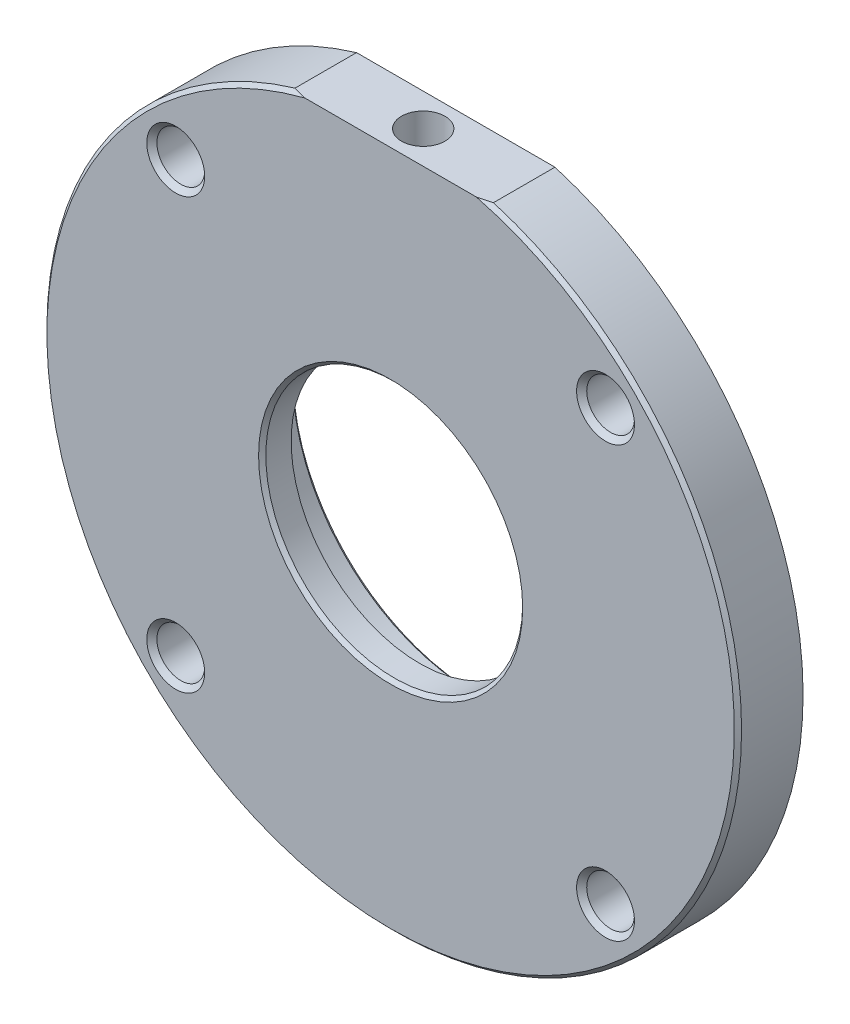
from build123d import *

# Parameters (mm, degrees)
CIRPATTERN1_COUNT               = 4
SKETCH4_W                       = 93.853238467
SKETCH4_H                       = 20.664933241
CUT_EXTRUDE1_DEPTH              = 69.476273263
F_3_0MM_DOWEL_HOLE1_D           = 3
F_3_0MM_DOWEL_HOLE1_DEPTH       = 9.098709071
F_3_0MM_DOWEL_HOLE1_CSINK_D     = 3.5
F_3_0MM_DOWEL_HOLE1_CSINK_ANGLE = 90
F_3_0MM_DOWEL_HOLE1_TIP         = 0.901290929


with BuildPart() as part:
    # Sketch1 → Revolve1 (revolve)
    with BuildSketch(Plane(origin=(0, 0, 0), x_dir=(0, 0, -1), z_dir=(1, 0, 0)), mode=Mode.PRIVATE) as revolve1_sk:
        Polygon((0, -18.25), (0, -47.5), (0.5, -48), (9, -48), (9, -36), (13.5, -36), (14, -35.5), (14, -30), (12, -30), (12, -25.5), (11.5, -25), (4, -25), (4, -17.75), (0.5, -17.75), align=None)
    revolve(revolve1_sk.sketch.rotate(Axis((0, 0, 0), (0, 0, -1)), 270), axis=Axis((0, 0, 0), (0, 0, -1)))

    # Sketch3 → Ø6.0mm Dowel Hole1 (revolve, cut)
    with BuildSketch(Plane(origin=(-29.69848481, 29.69848481, -9), x_dir=(0, 1, 0), z_dir=(1, 0, 0))):
        Polygon((0, 0), (0, 9), (4, 9), (3.3, 8.3), (3.3, 0.7), (4, 0), align=None)
    f_6_0mm_dowel_hole1 = revolve(axis=Axis((-29.69848481, 29.69848481, -15.35), (0, 0, 1)), mode=Mode.SUBTRACT)

    # CirPattern1: Ø6.0mm Dowel Hole1 ×4 about axis
    cirpattern1_axis = Axis((0, 0, 0), (0, 0, 1))
    for i in range(1, CIRPATTERN1_COUNT):
        add(f_6_0mm_dowel_hole1.rotate(cirpattern1_axis, i * 360 / CIRPATTERN1_COUNT), mode=Mode.SUBTRACT)

    # Sketch4 → Cut-Extrude1 (cut, through all)
    with BuildSketch(Plane(origin=(0, 0, -9), x_dir=(-1, 0, 0), z_dir=(0, 0, -1))):
        with Locations((-0.198842092, 56.33246662)):
            Rectangle(SKETCH4_W, SKETCH4_H)
    extrude(amount=-CUT_EXTRUDE1_DEPTH, mode=Mode.SUBTRACT)

    # Ø3.0mm Dowel Hole1
    with Locations(Plane(origin=(0, 0, -12), x_dir=(-1, 0, 0), z_dir=(0, 0, -1))):
        with Locations((0, 28)):
            CounterSinkHole(F_3_0MM_DOWEL_HOLE1_D / 2, F_3_0MM_DOWEL_HOLE1_CSINK_D / 2, depth=F_3_0MM_DOWEL_HOLE1_DEPTH, counter_sink_angle=F_3_0MM_DOWEL_HOLE1_CSINK_ANGLE)
            with Locations((0, 0, -(F_3_0MM_DOWEL_HOLE1_DEPTH + F_3_0MM_DOWEL_HOLE1_TIP / 2))):  # 118° drill point
                Cone(0, F_3_0MM_DOWEL_HOLE1_D / 2, F_3_0MM_DOWEL_HOLE1_TIP, mode=Mode.SUBTRACT)

    # Sketch9 → Hole1 (revolve, cut)
    with BuildSketch(Plane(origin=(0, 46, -4.5), x_dir=(0, 0, 1), z_dir=(1, 0, 0))):
        Polygon((0, 0), (0, 18), (1.5, 17.098709071), (1.5, 7.901290929), (3, 7), (3, 0), align=None)
    revolve(axis=Axis((0, 52.130023899, -4.5), (0, -1, 0)), mode=Mode.SUBTRACT)


solid = part.part
